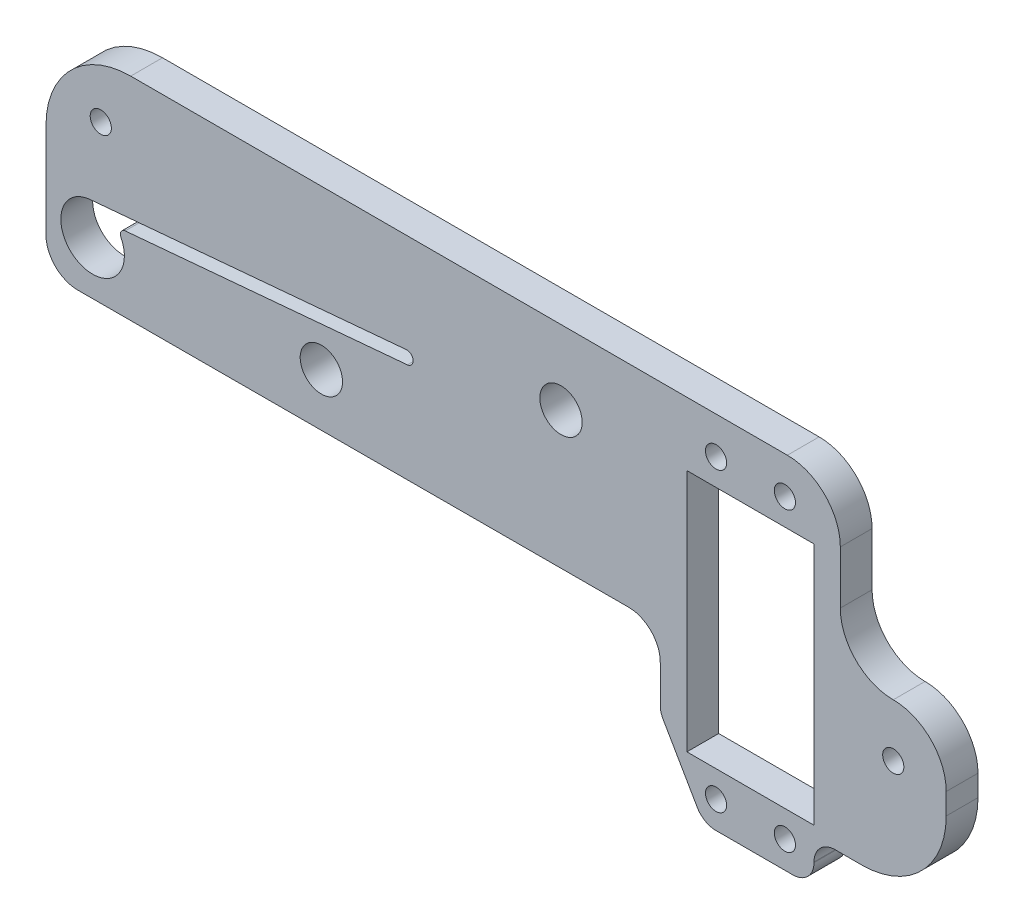
from build123d import *

# Parameters (mm, degrees)
SKETCH_1_R      = 1
SKETCH_1_R_2    = 2
SKETCH_1_W      = 12
SKETCH_1_H      = 23
EXTRUDE_1_DEPTH = 3


with BuildPart() as part:
    # 草图1 → 凸台-拉伸1 (new body)
    with BuildSketch(Plane.XY):
        with BuildLine():
            Line((32, -8), (32, -11.464101615))
            ThreePointArc((32, -11.464101615), (32.068166714, -11.981729308), (32.268018761, -12.464061443))
            Line((32.268018761, -12.464061443), (35.500063979, -18.060190477))
            ThreePointArc((35.500063979, -18.060190477), (36.232094687, -18.7920566), (37.231964862, -19.059930845))
            Line((37.231964862, -19.059930845), (44.515960818, -19.059930845))
            ThreePointArc((44.515960818, -19.059930845), (45.93017438, -18.474144407), (46.515960818, -17.059930845))
            Line((46.515960818, -17.059930845), (46.515960818, -17))
            ThreePointArc((46.515960818, -17), (47.101747256, -15.585786438), (48.515960818, -15))
            Line((48.515960818, -15), (51, -15))
            ThreePointArc((51, -15), (56.656854249, -12.656854249), (59, -7))
            Line((59, -7), (59, -5))
            ThreePointArc((59, -5), (57.535533906, -1.464466094), (54, 0))
            ThreePointArc((54, 0), (50.464466094, 1.464466094), (49, 5))
            Line((49, 5), (49, 10))
            ThreePointArc((49, 10), (47.535533906, 13.535533906), (44, 15))
            Line((44, 15), (-18, 15))
            ThreePointArc((-18, 15), (-23.656854249, 12.656854249), (-26, 7))
            Line((-26, 7), (-26, -2))
            ThreePointArc((-26, -2), (-25.121320344, -4.121320344), (-23, -5))
            Line((-23, -5), (28.999778597, -4.924134531))
            ThreePointArc((28.999778597, -4.924134531), (31.148522662, -5.829385596), (32, -8))
        make_face()
        with Locations((-20.828427125, 9.828427125)):
            Circle(SKETCH_1_R, mode=Mode.SUBTRACT)
        Circle(SKETCH_1_R_2, mode=Mode.SUBTRACT)
        with Locations((22.627416998, 8)):
            Circle(SKETCH_1_R_2, mode=Mode.SUBTRACT)
        with Locations((37.265960818, 11.5)):
            Circle(SKETCH_1_R, mode=Mode.SUBTRACT)
        with Locations((43.765960818, 11.5)):
            Circle(SKETCH_1_R, mode=Mode.SUBTRACT)
        with Locations((54, -5)):
            Circle(SKETCH_1_R, mode=Mode.SUBTRACT)
        with Locations(Location((43.765960818, -16.5, 0), (0, 0, 180))):
            Circle(SKETCH_1_R, mode=Mode.SUBTRACT)
        with Locations(Location((37.265960818, -16.5, 0), (0, 0, 180))):
            Circle(SKETCH_1_R, mode=Mode.SUBTRACT)
        with Locations((40.515960818, -2.5)):
            Rectangle(SKETCH_1_W, SKETCH_1_H, mode=Mode.SUBTRACT)
        with BuildLine():
            Line((-21.865827163, 2.988199444), (8.016167282, 5.646471071))
            ThreePointArc((8.016167282, 5.646471071), (8.666972603, 5.101996614), (8.122498147, 4.451191293))
            Line((8.122498147, 4.451191293), (-18.522663358, 2.08086501))
            ThreePointArc((-18.522663358, 2.08086501), (-18.915607181, 1.825347502), (-18.924307569, 1.356712945))
            ThreePointArc((-18.924307569, 1.356712945), (-23.055094396, -2.623490099), (-21.865827163, 2.988199444))
        make_face(mode=Mode.SUBTRACT)
    extrude(amount=EXTRUDE_1_DEPTH)


solid = part.part
